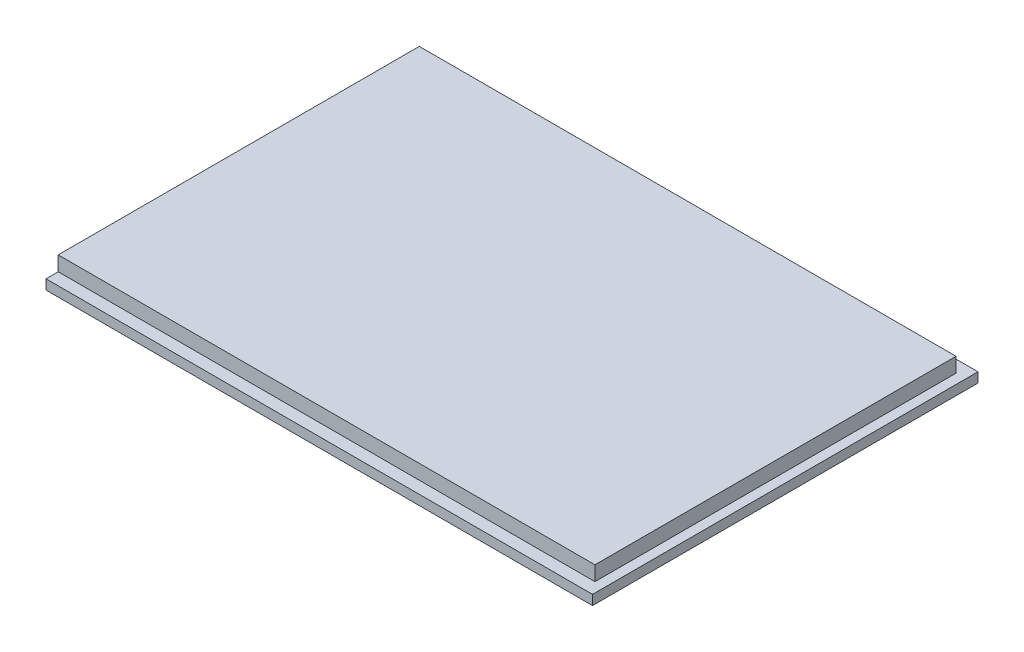
from build123d import *

# Parameters (mm, degrees)
SKETCH_2_W      = 44.8
SKETCH_2_H      = 31.6
EXTRUDE_1_DEPTH = 0.8
SKETCH_3_W      = 44
SKETCH_3_H      = 29.6
EXTRUDE_2_DEPTH = 1.2


with BuildPart() as part:
    # 草图2 → 凸台-拉伸1 (new body)
    with BuildSketch(Plane(origin=(0, 0, 0), x_dir=(1, 0, 0), z_dir=(0, 1, 0))):
        Rectangle(SKETCH_2_W, SKETCH_2_H)
    extrude(amount=EXTRUDE_1_DEPTH)

    # 草图3 → 凸台-拉伸2 (add)
    with BuildSketch(Plane(origin=(0, 0.8, 0), x_dir=(1, 0, 0), z_dir=(0, 1, 0))):
        with Locations((-0.4, 0)):
            Rectangle(SKETCH_3_W, SKETCH_3_H)
    extrude(amount=EXTRUDE_2_DEPTH)


solid = part.part
